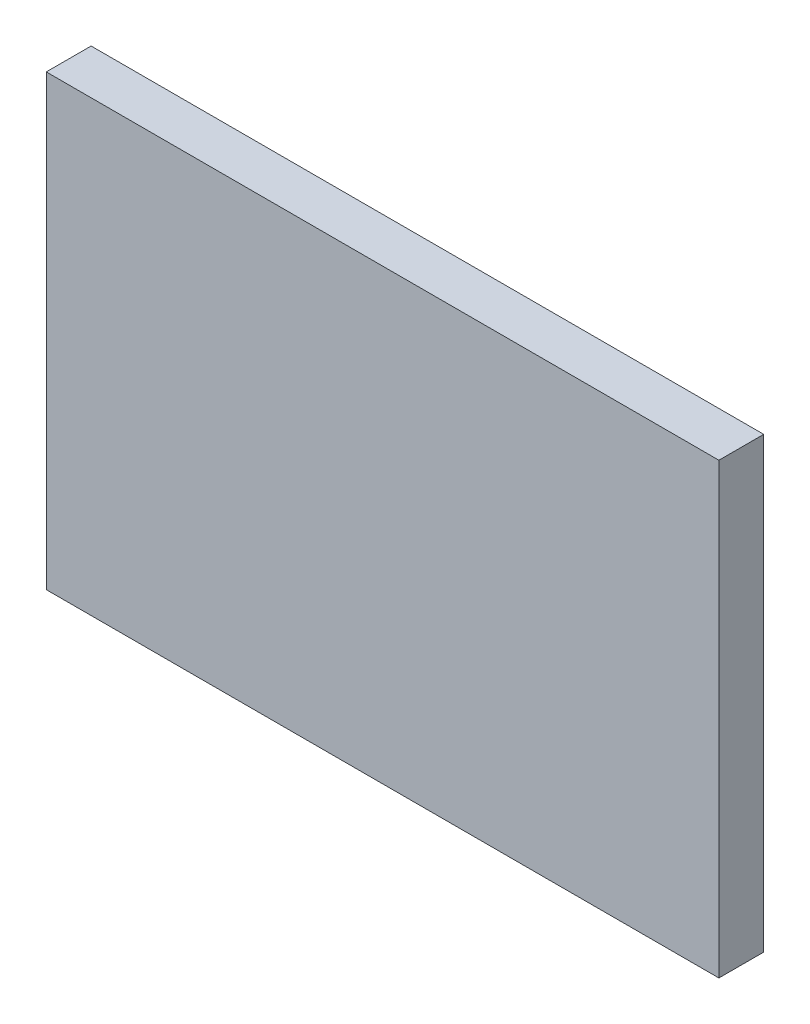
from build123d import *


with BuildPart() as part:
    # Skizze1 → Ausformung2 section 0
    with BuildSketch(Plane.XY):
        with BuildLine():
            Line((-15, 10), (-15, -10))
            Line((-15, -10), (15, -10))
            Line((15, -10), (15, 10))
            Line((15, 10), (-15, 10))
        make_face()
    # Skizze2 → Ausformung2 section 1
    with BuildSketch(Plane(origin=(0, 0, 2), x_dir=(-1, 0, 0), z_dir=(0, 0, -1))):
        with BuildLine():
            Line((15, 10), (15, -10))
            Line((15, -10), (-15, -10))
            Line((-15, -10), (-15, 10))
            Line((-15, 10), (15, 10))
        make_face()
    loft()


solid = part.part
